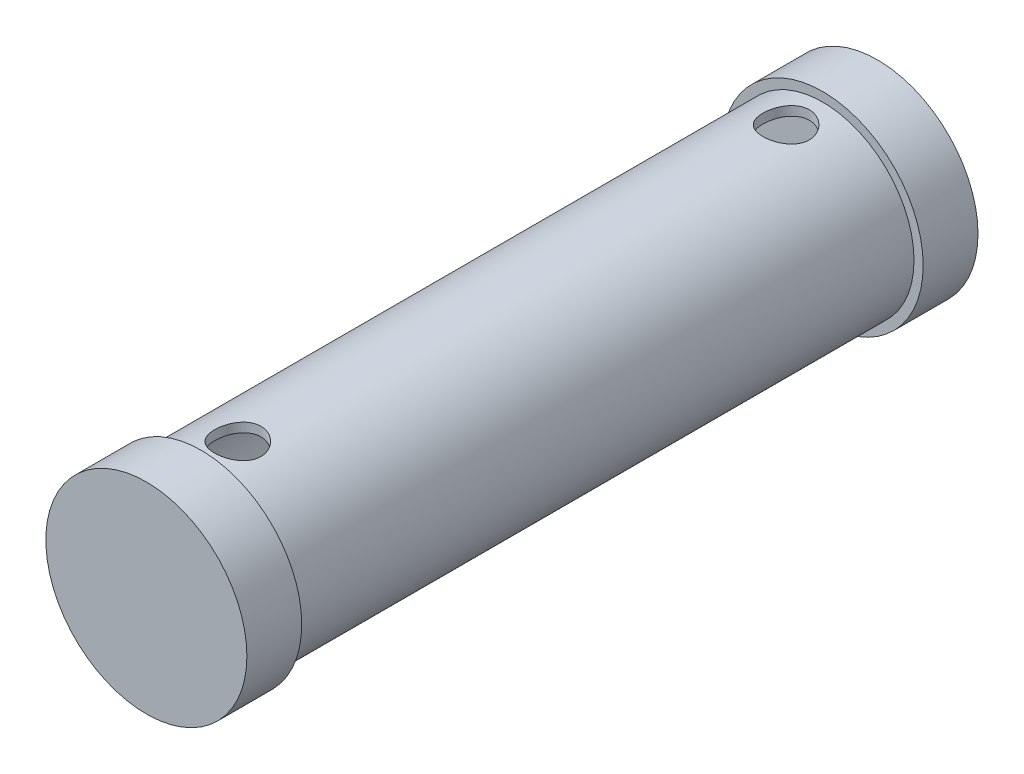
from build123d import *

# Parameters (mm, degrees)
CROQUIS1_R              = 50
CROQUIS1_R_2            = 45
SALIENTE_EXTRUIR1_DEPTH = 400
CROQUIS2_R              = 55
SALIENTE_EXTRUIR2_DEPTH = 30
SALIENTE_EXTRUIR3_START = -30
CROQUIS3_R              = 55
SALIENTE_EXTRUIR3_DEPTH = 30
CROQUIS5_R              = 12.7
CORTAR_EXTRUIR2_DEPTH   = 60
CROQUIS7_R              = 12.7
CORTAR_EXTRUIR4_DEPTH   = 106


with BuildPart() as part:
    # Croquis1 → Saliente-Extruir1 (new body)
    with BuildSketch(Plane.XY):
        Circle(CROQUIS1_R)
        Circle(CROQUIS1_R_2, mode=Mode.SUBTRACT)
    extrude(amount=SALIENTE_EXTRUIR1_DEPTH)

    # Croquis2 → Saliente-Extruir2 (add)
    with BuildSketch(Plane.XY):
        Circle(CROQUIS2_R)
    extrude(amount=SALIENTE_EXTRUIR2_DEPTH)

    # Croquis3 → Saliente-Extruir3 (add)
    with BuildSketch(Plane.XY.offset(400).offset(SALIENTE_EXTRUIR3_START)):
        Circle(CROQUIS3_R)
    extrude(amount=SALIENTE_EXTRUIR3_DEPTH)

    # Croquis5 → Cortar-Extruir2 (cut)
    with BuildSketch(Plane(origin=(0, 50, 0), x_dir=(1, 0, 0), z_dir=(0, 1, 0))):
        with Locations(Location((0, -350, 0), (0, 0, 270))):
            Circle(CROQUIS5_R)
        with Locations(Location((0, -50, 0), (0, 0, 270))):
            Circle(CROQUIS5_R)
    extrude(amount=-CORTAR_EXTRUIR2_DEPTH, mode=Mode.SUBTRACT)

    # Croquis7 → Cortar-Extruir4 (cut)
    with BuildSketch(Plane(origin=(0, 0, 0), x_dir=(0, 0, -1), z_dir=(1, 0, 0))):
        with Locations(Location((-200, 0, 0), (0, 0, 180))):
            Circle(CROQUIS7_R)
    extrude(amount=-CORTAR_EXTRUIR4_DEPTH, mode=Mode.SUBTRACT)


solid = part.part
